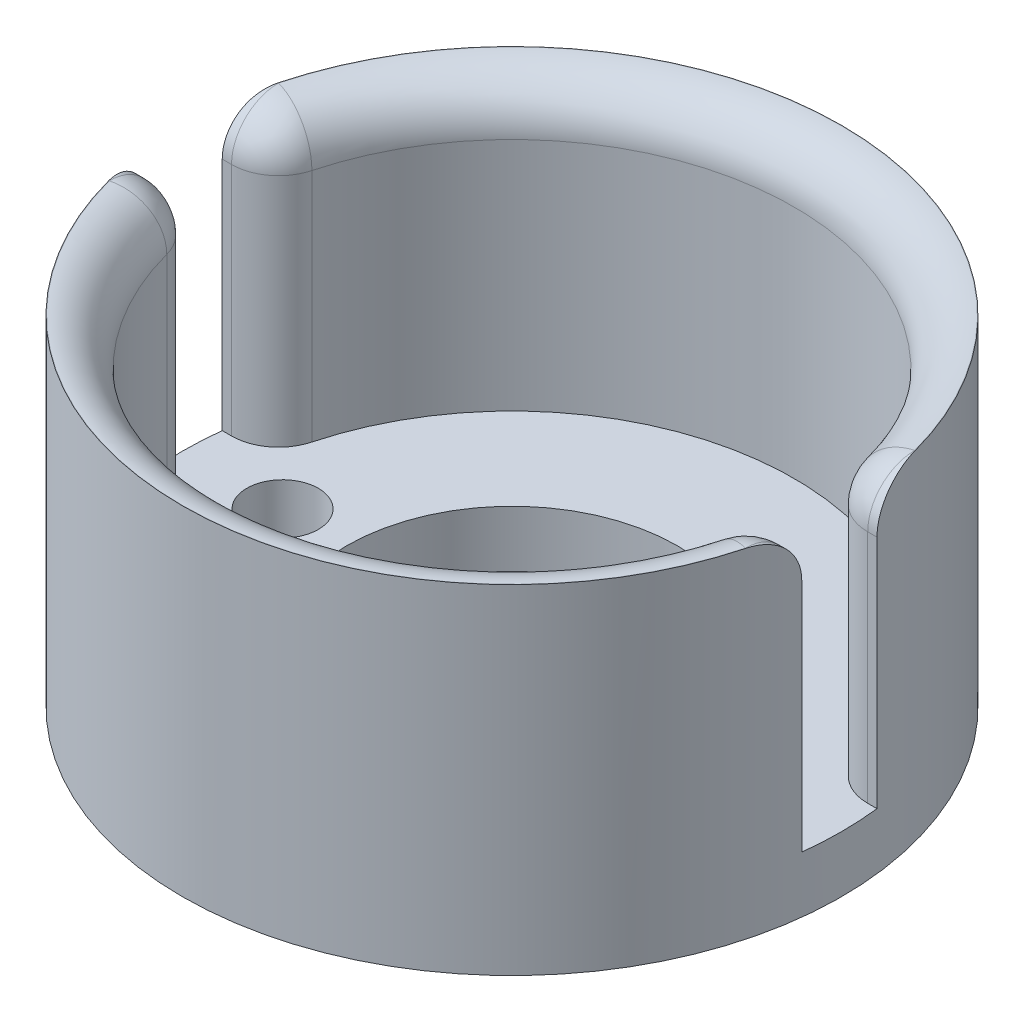
from build123d import *
from build123d.topology import SkipClean

# Parameters (mm, degrees)
SKETCH1_R           = 11.1252
SKETCH1_R_2         = 5.588
SKETCH1_R_3         = 1.2065
BOSS_EXTRUDE1_DEPTH = 1.905
BOSS_EXTRUDE2_DEPTH = 9.525
FILLET1_R           = 1.5875


with BuildPart() as part:
    # Sketch1 → Boss-Extrude1 (new body)
    with BuildSketch(Plane(origin=(0, 0, 0), x_dir=(1, 0, 0), z_dir=(0, 1, 0))):
        with Locations(Location((0, 0, 0), (0, 0, 90))):
            Circle(SKETCH1_R)
        with Locations(Location((0, 0, 0), (0, 0, 90))):
            Circle(SKETCH1_R_2, mode=Mode.SUBTRACT)
        with Locations(Location((-7.747, 0, 0), (0, 0, 90))):
            Circle(SKETCH1_R_3, mode=Mode.SUBTRACT)
        with Locations(Location((7.747, 0, 0), (0, 0, 90))):
            Circle(SKETCH1_R_3, mode=Mode.SUBTRACT)
    extrude(amount=BOSS_EXTRUDE1_DEPTH)

    # Sketch2 → Boss-Extrude2 (add)
    with SkipClean():  # the faces are left unmerged after this step: merging them gives an invalid solid
        with BuildSketch(Plane(origin=(0, 1.905, 0), x_dir=(1, 0, 0), z_dir=(0, 1, 0))):
            with BuildLine():
                Line((-9.439954, 1.27), (-11.052474, 1.27))
                ThreePointArc((-11.052474, 1.27), (0, 11.1252), (11.052474, 1.27))
                Line((11.052474, 1.27), (9.439954, 1.27))
                ThreePointArc((9.439954, 1.27), (0, 9.525), (-9.439954, 1.27))
            make_face()
            with BuildLine():
                Line((9.439954, -1.27), (11.052474, -1.27))
                ThreePointArc((11.052474, -1.27), (0, -11.1252), (-11.052474, -1.27))
                Line((-11.052474, -1.27), (-9.439954, -1.27))
                ThreePointArc((-9.439954, -1.27), (0, -9.525), (9.439954, -1.27))
            make_face()
        extrude(amount=BOSS_EXTRUDE2_DEPTH)

    # Fillet1
    fillet1_edges = [part.edges().sort_by_distance(p)[0] for p in [
        (10.246214, 11.43, 1.27),
        (10.246214, 11.43, -1.27),
        (-10.246214, 11.43, -1.27),
        (0, 11.43, -9.525),
        (0, 11.43, 9.525),
        (-10.246214, 11.43, 1.27),
        (9.439954, 6.6675, -1.27),
        (-9.439954, 6.6675, -1.27),
        (-9.439954, 6.6675, 1.27),
        (9.439954, 6.6675, 1.27),
    ]]
    fillet(fillet1_edges, radius=FILLET1_R)


solid = part.part
